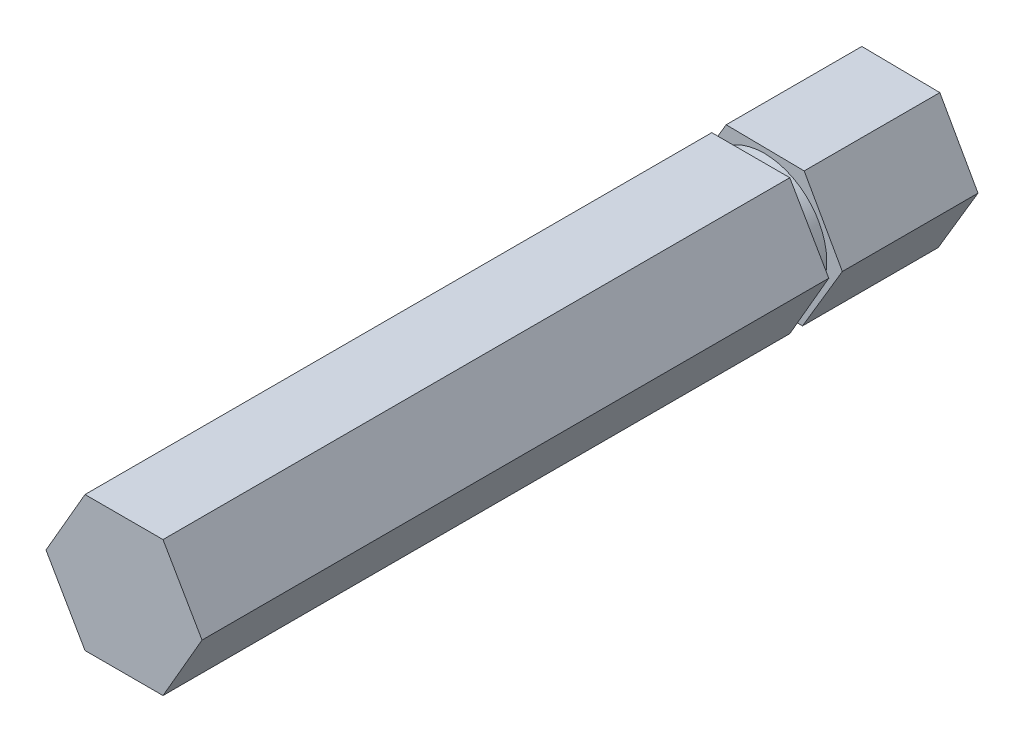
from build123d import *

# Parameters (mm, degrees)
BOSS_EXTRUDE1_DEPTH = 29.337
SKETCH1_R           = 5.842
BOSS_EXTRUDE2_DEPTH = 1.27
BOSS_EXTRUDE3_DEPTH = 12.7


with BuildPart() as part:
    # Sketch 1 → Boss-Extrude1 (new, symmetric)
    with BuildSketch(Plane.XY):
        Polygon((7.3025, 0), (3.65125, 6.324150511), (-3.65125, 6.324150511), (-7.3025, 0), (-3.65125, -6.324150511), (3.65125, -6.324150511), align=None)
    extrude(amount=BOSS_EXTRUDE1_DEPTH, both=True)

    # Sketch1 → Boss-Extrude2 (add)
    with BuildSketch(Plane(origin=(0, 0, -29.337), x_dir=(-1, 0, 0), z_dir=(0, 0, -1))):
        with Locations(Location((0, 0, 0), (0, 0, 180))):
            Circle(SKETCH1_R)
    extrude(amount=BOSS_EXTRUDE2_DEPTH)

    # Sketch2 → Boss-Extrude3 (add)
    with BuildSketch(Plane(origin=(0, 0, -30.607), x_dir=(-1, 0, 0), z_dir=(0, 0, -1))):
        Polygon((3.729553625, -6.278290851), (7.301936182, 0.090742758), (3.572382557, 6.369033609), (-3.729553625, 6.278290851), (-7.301936182, -0.090742758), (-3.572382557, -6.369033609), align=None)
    extrude(amount=BOSS_EXTRUDE3_DEPTH)


solid = part.part
